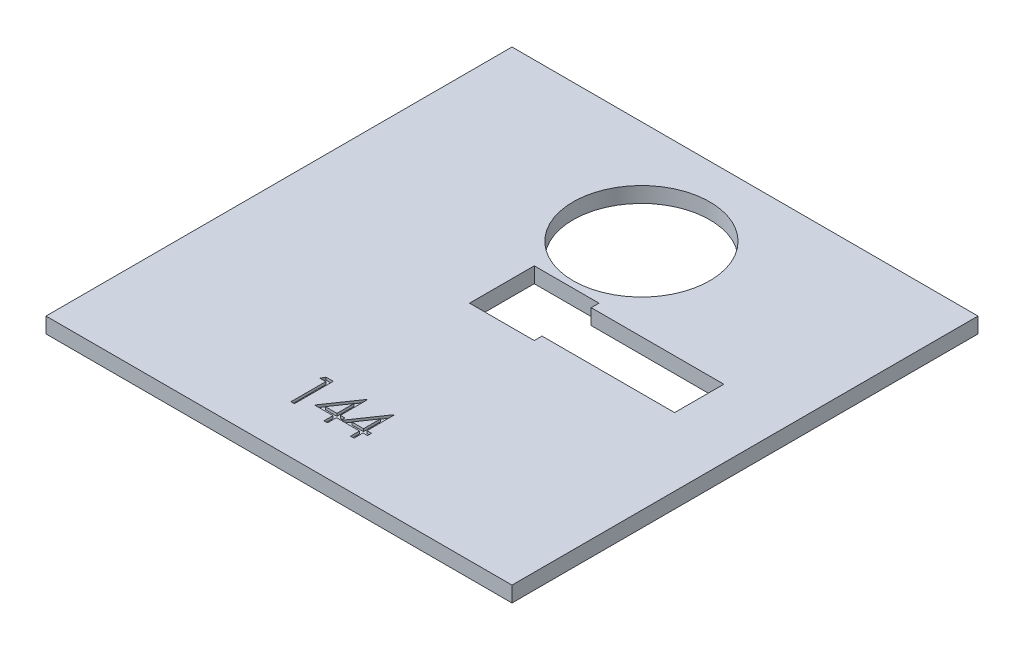
from build123d import *

# Parameters (mm, degrees)
SKETCH1_W           = 180
SKETCH1_H           = 180
SKETCH1_R           = 26.4
BOSS_EXTRUDE2_DEPTH = 6
CUT_EXTRUDE1_DEPTH  = 10
CUT_EXTRUDE2_DEPTH  = 1


with BuildPart() as part:
    # Sketch1 → Boss-Extrude2 (new body)
    with BuildSketch(Plane(origin=(0, 0, 0), x_dir=(1, 0, 0), z_dir=(0, 1, 0))):
        Rectangle(SKETCH1_W, SKETCH1_H)
        with Locations(Location((0, 50, 0), (0, 0, 270))):
            Circle(SKETCH1_R, mode=Mode.SUBTRACT)
    extrude(amount=BOSS_EXTRUDE2_DEPTH)

    # Sketch2 → Cut-Extrude1 (cut)
    with BuildSketch(Plane(origin=(0, 6, 0), x_dir=(1, 0, 0), z_dir=(0, 1, 0))):
        Polygon((-12.5, 21.1), (12.5, 21.1), (12.5, 18.1), (63.71, 18.1), (63.71, -0.9), (12.5, -0.9), (12.5, -3.9), (-12.5, -3.9), align=None)
    extrude(amount=-CUT_EXTRUDE1_DEPTH, mode=Mode.SUBTRACT)

    # Sketch3 → Cut-Extrude2 (cut)
    # profile 1 of 3: a face of its own
    with BuildSketch(Plane(origin=(0, 6, 0), x_dir=(1, 0, 0), z_dir=(0, 1, 0))):
        Polygon((-15.459341638, -56.364917997), (-12.685904138, -56.364917997), (-12.685904138, -71.364917997), (-14.032057985, -71.364917997), (-14.032057985, -57.903379535), (-16.339750292, -57.903379535), align=None)
    # profile 2 of 3: a face of its own
    with BuildSketch(Plane(origin=(0, 6, 0), x_dir=(1, 0, 0), z_dir=(0, 1, 0))):
        Polygon((-0.190110869, -55.980302612), (0.083326631, -55.980302612), (0.083326631, -66.364917997), (1.814095862, -66.364917997), (1.814095862, -67.903379535), (0.083326631, -67.903379535), (0.083326631, -71.364917997), (-1.262827215, -71.364917997), (-1.262827215, -67.903379535), (-8.378211831, -67.903379535), align=None)
        Polygon((-1.262827215, -66.364917997), (-1.262827215, -59.85049492), (-5.733981062, -66.364917997), align=None, mode=Mode.SUBTRACT)
    # profile 3 of 3: a face of its own
    with BuildSketch(Plane(origin=(0, 6, 0), x_dir=(1, 0, 0), z_dir=(0, 1, 0))):
        Polygon((10.0791199, -55.980302612), (10.3525574, -55.980302612), (10.3525574, -66.364917997), (12.083326631, -66.364917997), (12.083326631, -67.903379535), (10.3525574, -67.903379535), (10.3525574, -71.364917997), (9.006403554, -71.364917997), (9.006403554, -67.903379535), (1.891018938, -67.903379535), align=None)
        Polygon((9.006403554, -66.364917997), (9.006403554, -59.85049492), (4.535249708, -66.364917997), align=None, mode=Mode.SUBTRACT)
    extrude(amount=-CUT_EXTRUDE2_DEPTH, mode=Mode.SUBTRACT)


solid = part.part
